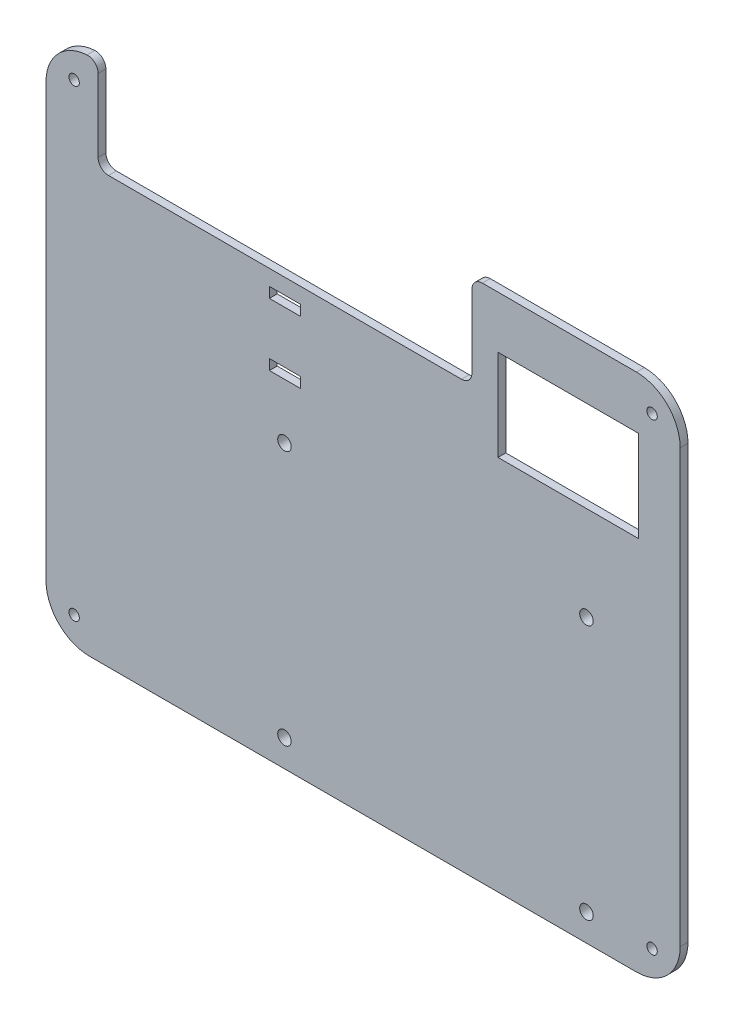
from build123d import *

# Parameters (mm, degrees)
AUFSATZ_LINEAR_AUSTRAGEN1_DEPTH = 1.5
SCHNITT_LINEAR_AUSTRAGEN1_REACH = 159.472
SKIZZE2_R                       = 1.3
SKIZZE2_R_2                     = 1
SCHNITT_LINEAR_AUSTRAGEN2_REACH = 159.472
SKIZZE3_W                       = 27
SKIZZE3_H                       = 17.5
SKIZZE4_R                       = 2.5
SKIZZE4_R_2                     = 1.3
AUFSATZ_LINEAR_AUSTRAGEN2_DEPTH = 3
VERRUNDUNG1_R                   = 2
SCHNITT_LINEAR_AUSTRAGEN3_REACH = 159.494
SKIZZE5_W                       = 71.8
SKIZZE5_H                       = 18
VERRUNDUNG2_R                   = 2
SCHNITT_LINEAR_AUSTRAGEN4_REACH = 159.494
SKIZZE6_W                       = 6
SKIZZE6_H                       = 2


with BuildPart() as part:
    # Skizze1 → Aufsatz-Linear austragen1 (new body)
    with BuildSketch(Plane.XY):
        with BuildLine():
            Line((8.4, 0), (113.4, 0))
            ThreePointArc((113.4, 0), (119.339696962, 2.460303038), (121.8, 8.4))
            Line((121.8, 8.4), (121.8, 91.4))
            ThreePointArc((121.8, 91.4), (119.339696962, 97.339696962), (113.4, 99.8))
            Line((113.4, 99.8), (8.4, 99.8))
            ThreePointArc((8.4, 99.8), (2.460303038, 97.339696962), (0, 91.4))
            Line((0, 91.4), (0, 8.4))
            ThreePointArc((0, 8.4), (2.460303038, 2.460303038), (8.4, 0))
        make_face()
    extrude(amount=AUFSATZ_LINEAR_AUSTRAGEN1_DEPTH)

    # Skizze2 → Schnitt-Linear austragen1 (cut, up to next)
    with BuildSketch(Plane.XY.offset(1.5), mode=Mode.PRIVATE) as schnitt_linear_austragen1_sk1:
        with Locations((45.8, 54.2)):
            Circle(SKIZZE2_R)
    schnitt_linear_austragen1_tool1 = extrude(schnitt_linear_austragen1_sk1.sketch, amount=-SCHNITT_LINEAR_AUSTRAGEN1_REACH, mode=Mode.PRIVATE) & part.part
    # Skizze2 → Schnitt-Linear austragen1 (cut, up to next)
    with BuildSketch(Plane.XY.offset(1.5), mode=Mode.PRIVATE) as schnitt_linear_austragen1_sk2:
        with Locations((45.8, 5.2)):
            Circle(SKIZZE2_R)
    schnitt_linear_austragen1_tool2 = extrude(schnitt_linear_austragen1_sk2.sketch, amount=-SCHNITT_LINEAR_AUSTRAGEN1_REACH, mode=Mode.PRIVATE) & part.part
    # Skizze2 → Schnitt-Linear austragen1 (cut, up to next)
    with BuildSketch(Plane.XY.offset(1.5), mode=Mode.PRIVATE) as schnitt_linear_austragen1_sk3:
        with Locations((103.8, 54.2)):
            Circle(SKIZZE2_R)
    schnitt_linear_austragen1_tool3 = extrude(schnitt_linear_austragen1_sk3.sketch, amount=-SCHNITT_LINEAR_AUSTRAGEN1_REACH, mode=Mode.PRIVATE) & part.part
    # Skizze2 → Schnitt-Linear austragen1 (cut, up to next)
    with BuildSketch(Plane.XY.offset(1.5), mode=Mode.PRIVATE) as schnitt_linear_austragen1_sk4:
        with Locations((103.8, 5.2)):
            Circle(SKIZZE2_R)
    schnitt_linear_austragen1_tool4 = extrude(schnitt_linear_austragen1_sk4.sketch, amount=-SCHNITT_LINEAR_AUSTRAGEN1_REACH, mode=Mode.PRIVATE) & part.part
    # Skizze2 → Schnitt-Linear austragen1 (cut, up to next)
    with BuildSketch(Plane.XY.offset(1.5), mode=Mode.PRIVATE) as schnitt_linear_austragen1_sk5:
        with Locations((5.4, 94.4)):
            Circle(SKIZZE2_R_2)
    schnitt_linear_austragen1_tool5 = extrude(schnitt_linear_austragen1_sk5.sketch, amount=-SCHNITT_LINEAR_AUSTRAGEN1_REACH, mode=Mode.PRIVATE) & part.part
    # Skizze2 → Schnitt-Linear austragen1 (cut, up to next)
    with BuildSketch(Plane.XY.offset(1.5), mode=Mode.PRIVATE) as schnitt_linear_austragen1_sk6:
        with Locations((116.4, 94.4)):
            Circle(SKIZZE2_R_2)
    schnitt_linear_austragen1_tool6 = extrude(schnitt_linear_austragen1_sk6.sketch, amount=-SCHNITT_LINEAR_AUSTRAGEN1_REACH, mode=Mode.PRIVATE) & part.part
    # Skizze2 → Schnitt-Linear austragen1 (cut, up to next)
    with BuildSketch(Plane.XY.offset(1.5), mode=Mode.PRIVATE) as schnitt_linear_austragen1_sk7:
        with Locations((116.4, 5.4)):
            Circle(SKIZZE2_R_2)
    schnitt_linear_austragen1_tool7 = extrude(schnitt_linear_austragen1_sk7.sketch, amount=-SCHNITT_LINEAR_AUSTRAGEN1_REACH, mode=Mode.PRIVATE) & part.part
    # Skizze2 → Schnitt-Linear austragen1 (cut, up to next)
    with BuildSketch(Plane.XY.offset(1.5), mode=Mode.PRIVATE) as schnitt_linear_austragen1_sk8:
        with Locations((5.4, 5.4)):
            Circle(SKIZZE2_R_2)
    schnitt_linear_austragen1_tool8 = extrude(schnitt_linear_austragen1_sk8.sketch, amount=-SCHNITT_LINEAR_AUSTRAGEN1_REACH, mode=Mode.PRIVATE) & part.part
    add(schnitt_linear_austragen1_tool1.solids().sort_by_distance((45.8, 54.2, 1.5))[0], mode=Mode.SUBTRACT)
    add(schnitt_linear_austragen1_tool2.solids().sort_by_distance((45.8, 5.2, 1.5))[0], mode=Mode.SUBTRACT)
    add(schnitt_linear_austragen1_tool3.solids().sort_by_distance((103.8, 54.2, 1.5))[0], mode=Mode.SUBTRACT)
    add(schnitt_linear_austragen1_tool4.solids().sort_by_distance((103.8, 5.2, 1.5))[0], mode=Mode.SUBTRACT)
    add(schnitt_linear_austragen1_tool5.solids().sort_by_distance((5.4, 94.4, 1.5))[0], mode=Mode.SUBTRACT)
    add(schnitt_linear_austragen1_tool6.solids().sort_by_distance((116.4, 94.4, 1.5))[0], mode=Mode.SUBTRACT)
    add(schnitt_linear_austragen1_tool7.solids().sort_by_distance((116.4, 5.4, 1.5))[0], mode=Mode.SUBTRACT)
    add(schnitt_linear_austragen1_tool8.solids().sort_by_distance((5.4, 5.4, 1.5))[0], mode=Mode.SUBTRACT)

    # Skizze3 → Schnitt-Linear austragen2 (cut, up to next)
    with BuildSketch(Plane.XY.offset(1.5), mode=Mode.PRIVATE) as schnitt_linear_austragen2_sk1:
        with Locations((100.3, 81.05)):
            Rectangle(SKIZZE3_W, SKIZZE3_H)
    schnitt_linear_austragen2_tool1 = extrude(schnitt_linear_austragen2_sk1.sketch, amount=-SCHNITT_LINEAR_AUSTRAGEN2_REACH, mode=Mode.PRIVATE) & part.part
    add(schnitt_linear_austragen2_tool1.solids().sort_by_distance((100.3, 81.05, 1.5))[0], mode=Mode.SUBTRACT)

    # Skizze4 → Aufsatz-Linear austragen2 (add)
    # profile 1 of 4: a face of its own
    with BuildSketch(Plane(origin=(0, 0, 0), x_dir=(-1, 0, 0), z_dir=(0, 0, -1))):
        with Locations((-103.8, 54.2)):
            Circle(SKIZZE4_R)
        with Locations(Location((-103.8, 54.2, 0), (0, 0, 180))):
            Circle(SKIZZE4_R_2, mode=Mode.SUBTRACT)
    # profile 2 of 4: a face of its own
    with BuildSketch(Plane(origin=(0, 0, 0), x_dir=(-1, 0, 0), z_dir=(0, 0, -1))):
        with Locations((-45.8, 54.2)):
            Circle(SKIZZE4_R)
        with Locations(Location((-45.8, 54.2, 0), (0, 0, 180))):
            Circle(SKIZZE4_R_2, mode=Mode.SUBTRACT)
    # profile 3 of 4: a face of its own
    with BuildSketch(Plane(origin=(0, 0, 0), x_dir=(-1, 0, 0), z_dir=(0, 0, -1))):
        with Locations((-45.8, 5.2)):
            Circle(SKIZZE4_R)
        with Locations(Location((-45.8, 5.2, 0), (0, 0, 180))):
            Circle(SKIZZE4_R_2, mode=Mode.SUBTRACT)
    # profile 4 of 4: a face of its own
    with BuildSketch(Plane(origin=(0, 0, 0), x_dir=(-1, 0, 0), z_dir=(0, 0, -1))):
        with Locations((-103.8, 5.2)):
            Circle(SKIZZE4_R)
        with Locations(Location((-103.8, 5.2, 0), (0, 0, 180))):
            Circle(SKIZZE4_R_2, mode=Mode.SUBTRACT)
    extrude(amount=AUFSATZ_LINEAR_AUSTRAGEN2_DEPTH)

    # Verrundung1
    verrundung1_edges = [part.edges().sort_by_distance(p)[0] for p in [
        (106.3, 54.2, 0),
        (48.3, 54.2, 0),
        (48.3, 5.2, 0),
        (106.3, 5.2, 0),
    ]]
    fillet(verrundung1_edges, radius=VERRUNDUNG1_R)

    # Skizze5 → Schnitt-Linear austragen3 (cut, up to next)
    with BuildSketch(Plane(origin=(0, 0, 0), x_dir=(-1, 0, 0), z_dir=(0, 0, -1)), mode=Mode.PRIVATE) as schnitt_linear_austragen3_sk1:
        with Locations((-45.9, 90.8)):
            Rectangle(SKIZZE5_W, SKIZZE5_H)
    schnitt_linear_austragen3_tool1 = extrude(schnitt_linear_austragen3_sk1.sketch, amount=-SCHNITT_LINEAR_AUSTRAGEN3_REACH, mode=Mode.PRIVATE) & part.part
    add(schnitt_linear_austragen3_tool1.solids().sort_by_distance((45.9, 90.8, 0))[0], mode=Mode.SUBTRACT)

    # Verrundung2
    verrundung2_edges = [part.edges().sort_by_distance(p)[0] for p in [
        (10, 81.8, 0.75),
        (81.8, 81.8, 0.75),
        (10, 99.8, 0.75),
        (81.8, 99.8, 0.75),
    ]]
    fillet(verrundung2_edges, radius=VERRUNDUNG2_R)

    # Skizze6 → Schnitt-Linear austragen4 (cut, up to next)
    with BuildSketch(Plane(origin=(0, 0, 0), x_dir=(-1, 0, 0), z_dir=(0, 0, -1)), mode=Mode.PRIVATE) as schnitt_linear_austragen4_sk1:
        with Locations((-45.9, 77.8)):
            Rectangle(SKIZZE6_W, SKIZZE6_H)
    schnitt_linear_austragen4_tool1 = extrude(schnitt_linear_austragen4_sk1.sketch, amount=-SCHNITT_LINEAR_AUSTRAGEN4_REACH, mode=Mode.PRIVATE) & part.part
    # Skizze6 → Schnitt-Linear austragen4 (cut, up to next)
    with BuildSketch(Plane(origin=(0, 0, 0), x_dir=(-1, 0, 0), z_dir=(0, 0, -1)), mode=Mode.PRIVATE) as schnitt_linear_austragen4_sk2:
        with Locations((-45.9, 65.8)):
            Rectangle(SKIZZE6_W, SKIZZE6_H)
    schnitt_linear_austragen4_tool2 = extrude(schnitt_linear_austragen4_sk2.sketch, amount=-SCHNITT_LINEAR_AUSTRAGEN4_REACH, mode=Mode.PRIVATE) & part.part
    add(schnitt_linear_austragen4_tool1.solids().sort_by_distance((45.9, 77.8, 0))[0], mode=Mode.SUBTRACT)
    add(schnitt_linear_austragen4_tool2.solids().sort_by_distance((45.9, 65.8, 0))[0], mode=Mode.SUBTRACT)


solid = part.part
